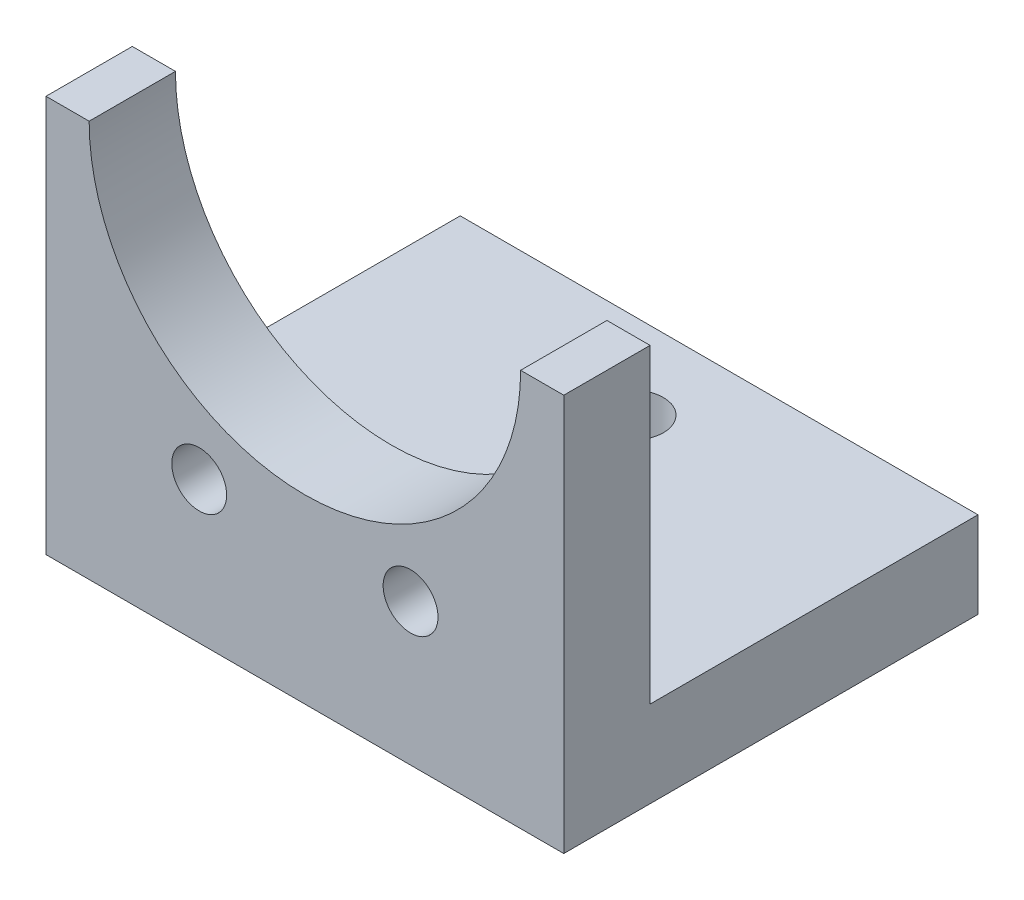
from build123d import *

# Parameters (mm, degrees)
SKETCH1_W                       = 38.1
SKETCH1_H                       = 30.48
EXTRUDE1_DEPTH                  = 6.35
SKETCH2_W                       = 38.1
SKETCH2_H                       = 6.35
EXTRUDE2_DEPTH                  = 22.86
F_16_0_177_DIAMETER_HOLE3_D     = 4.4958
F_16_0_177_DIAMETER_HOLE3_DEPTH = 58.42
F_16_0_177_DIAMETER_HOLE3_TIP   = 1.350674586
SKETCH6_R                       = 15.875
CUT_EXTRUDE2_DEPTH              = 25.4
F_10_32_TAPPED_HOLE1_D          = 4.0386
CIRPATTERN1_COUNT               = 2
CIRPATTERN1_ANGLE               = 45


with BuildPart() as part:
    # Sketch1 → Extrude1 (new body)
    with BuildSketch(Plane(origin=(0, 0, 0), x_dir=(1, 0, 0), z_dir=(0, 1, 0))):
        with Locations((0, -2.54)):
            Rectangle(SKETCH1_W, SKETCH1_H)
    extrude(amount=EXTRUDE1_DEPTH)

    # Sketch2 → Extrude2 (add)
    with BuildSketch(Plane(origin=(0, 6.35, 0), x_dir=(-1, 0, 0), z_dir=(0, 1, 0))):
        with Locations((0, 14.605)):
            Rectangle(SKETCH2_W, SKETCH2_H)
    extrude(amount=EXTRUDE2_DEPTH)

    # #16 (0.177) Diameter Hole3
    with Locations(Plane(origin=(0, 6.35, 6.35), x_dir=(0, 0, 1), z_dir=(0, 1, 0))):
        with Locations((0, 0), (-12.7, 0)):
            Hole(F_16_0_177_DIAMETER_HOLE3_D / 2, depth=F_16_0_177_DIAMETER_HOLE3_DEPTH)
            with Locations((0, 0, -(F_16_0_177_DIAMETER_HOLE3_DEPTH + F_16_0_177_DIAMETER_HOLE3_TIP / 2))):  # 118° drill point
                Cone(0, F_16_0_177_DIAMETER_HOLE3_D / 2, F_16_0_177_DIAMETER_HOLE3_TIP, mode=Mode.SUBTRACT)

    # Sketch6 → Cut-Extrude2 (cut)
    with BuildSketch(Plane.XY.offset(17.78)):
        with Locations((0, 29.21)):
            Circle(SKETCH6_R)
    extrude(amount=-CUT_EXTRUDE2_DEPTH, mode=Mode.SUBTRACT)

    # #10-32 Tapped Hole1 (through all)
    with Locations(Plane(origin=(7.776127346, 10.436767899, 17.78), x_dir=(1, 0, 0), z_dir=(0, 0, 1))):
        with Locations((0, 0)):
            f_10_32_tapped_hole1 = Hole(F_10_32_TAPPED_HOLE1_D / 2)

    # CirPattern1: #10-32 Tapped Hole1 ×2 about axis
    cirpattern1_axis = Axis((0, 29.21, 35.207153655), (0, 0, -1))
    for i in range(1, CIRPATTERN1_COUNT):
        add(f_10_32_tapped_hole1.rotate(cirpattern1_axis, i * CIRPATTERN1_ANGLE / (CIRPATTERN1_COUNT - 1)), mode=Mode.SUBTRACT)


solid = part.part
